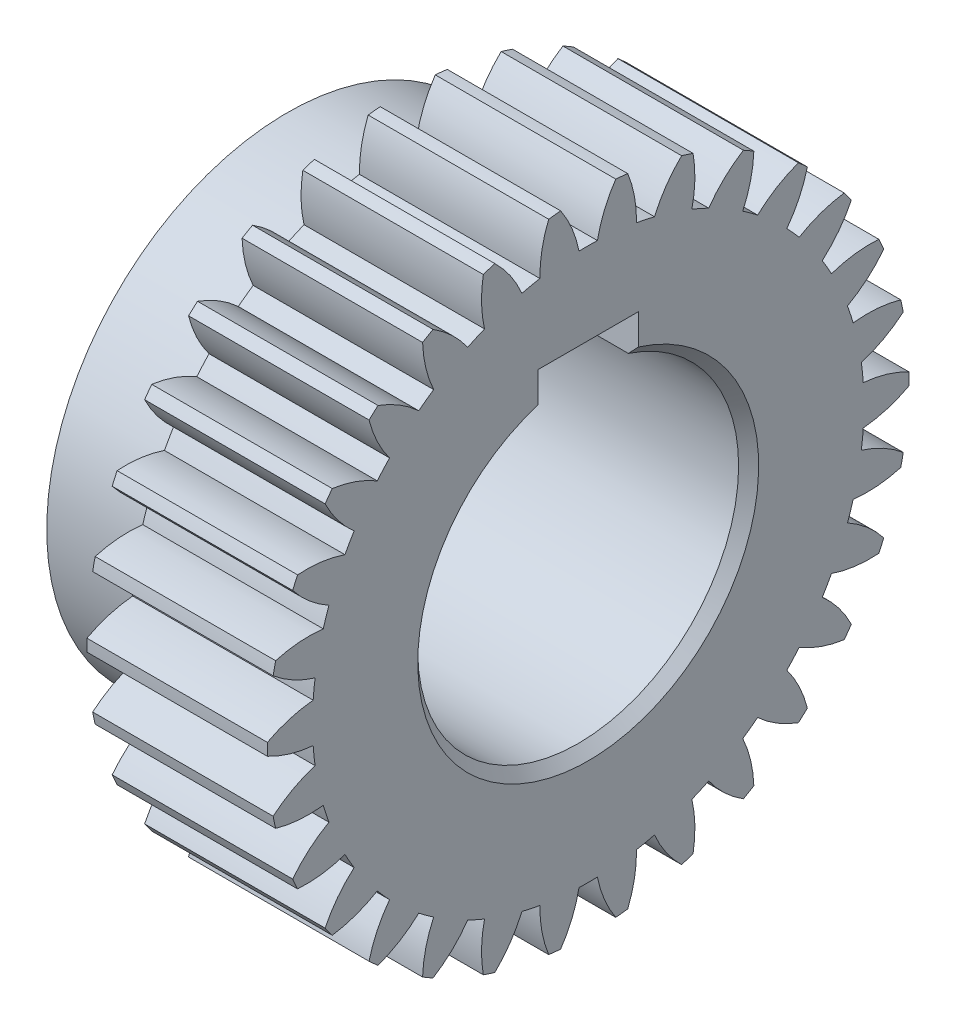
from build123d import *

# Parameters (mm, degrees)
BASPROSKE_W      = 18
BASPROSKE_H      = 32
TOOTHCUT_DEPTH   = 49.703182648
TEETHCUTS_COUNT  = 30
HUBNEAONESKE_R   = 24
HUBNEARONE_DEPTH = 12.0000508
BORSKE_R         = 16
BORE_DEPTH       = 30.0000508
KEYSKE_W         = 10
KEYSKE_H         = 19.3
KEYWAY_DEPTH     = 30.0000508
SMUSSO1_SIZE     = 1
RACCORDO1_R      = 1


with BuildPart() as part:
    # BasProSke → Base-Revolve (revolve)
    with BuildSketch(Plane(origin=(0, 0, 0), x_dir=(1, 0, 0), z_dir=(0, 1, 0)), mode=Mode.PRIVATE) as base_revolve_sk:
        with Locations((9, 16)):
            Rectangle(BASPROSKE_W, BASPROSKE_H)
    revolve(base_revolve_sk.sketch.rotate(Axis((-10, 0, 0), (1, 0, 0)), 180), axis=Axis((-10, 0, 0), (1, 0, 0)))

    # TooCutSke → ToothCut (cut, through all)
    with BuildSketch(Plane(origin=(0, 0, 0), x_dir=(0, 0, -1), z_dir=(1, 0, 0))):
        with BuildLine():
            ThreePointArc((0.918551563, 27.483654488), (0, 27.499), (-0.918551563, 27.483654488))
            ThreePointArc((-0.918551563, 27.483654488), (-1.617208176, 29.787801627), (-2.761784709, 31.906093311))
            ThreePointArc((-2.761784709, 31.906093311), (0, 32.0254), (2.761784709, 31.906093311))
            ThreePointArc((2.761784709, 31.906093311), (1.617208176, 29.787801627), (0.918551563, 27.483654488))
        make_face()
    toothcut = extrude(amount=TOOTHCUT_DEPTH, mode=Mode.SUBTRACT)

    # TeethCuts: ToothCut ×30 about axis
    teethcuts_axis = Axis((0, 0, 0), (1, 0, 0))
    for i in range(1, TEETHCUTS_COUNT):
        add(toothcut.rotate(teethcuts_axis, i * 360 / TEETHCUTS_COUNT), mode=Mode.SUBTRACT)

    # HubNeaOneSke → HubNearOne (add)
    with BuildSketch(Plane.ZY):
        with Locations(Location((0, 0, 0), (0, 0, 180))):
            Circle(HUBNEAONESKE_R)
    extrude(amount=HUBNEARONE_DEPTH)

    # BorSke → Bore (cut, symmetric)
    with BuildSketch(Plane(origin=(0, 0, 0), x_dir=(0, 0, -1), z_dir=(1, 0, 0))):
        with Locations(Location((0, 0, 0), (0, 0, 180))):
            Circle(BORSKE_R)
    extrude(amount=BORE_DEPTH, both=True, mode=Mode.SUBTRACT)

    # KeySke → Keyway (cut, symmetric)
    with BuildSketch(Plane(origin=(0, 0, 0), x_dir=(0, 0, -1), z_dir=(1, 0, 0))):
        with Locations((0, 9.65)):
            Rectangle(KEYSKE_W, KEYSKE_H)
    extrude(amount=KEYWAY_DEPTH, both=True, mode=Mode.SUBTRACT)

    # Smusso1
    smusso1_edges = [part.edges().sort_by_distance(p)[0] for p in [
        (18, -16, 0),
    ]]
    chamfer(smusso1_edges, length=SMUSSO1_SIZE)

    # Raccordo1
    raccordo1_edges = [part.edges().sort_by_distance(p)[0] for p in [
        (0, 0, 24),
    ]]
    fillet(raccordo1_edges, radius=RACCORDO1_R)


solid = part.part
